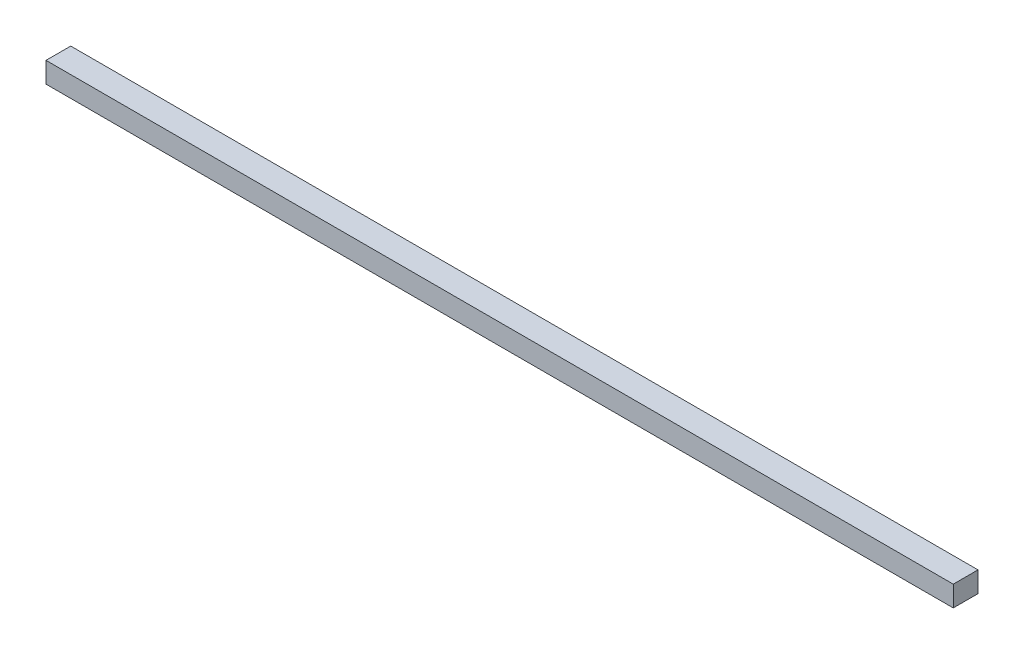
from build123d import *

# Parameters (mm, degrees)
SKETCH1_W           = 19.05
SKETCH1_H           = 15.875
BOSS_EXTRUDE1_DEPTH = 349.25


with BuildPart() as part:
    # Sketch1 → Boss-Extrude1 (new, symmetric)
    with BuildSketch(Plane(origin=(0, 0, 0), x_dir=(0, 0, -1), z_dir=(1, 0, 0))):
        Rectangle(SKETCH1_W, SKETCH1_H)
    extrude(amount=BOSS_EXTRUDE1_DEPTH, both=True)


solid = part.part
